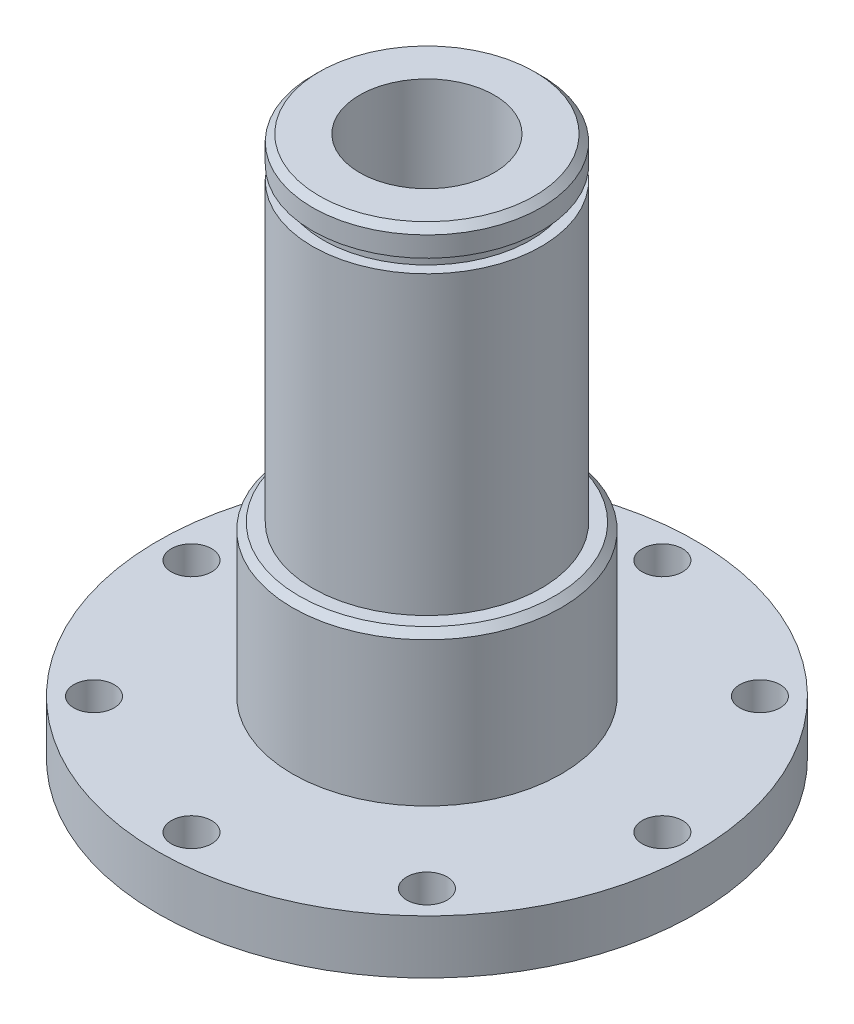
from build123d import *

# Parameters (mm, degrees)
SKETCH_1_R          = 20
EXTRUDE_1_DEPTH     = 4
SKETCH_2_R          = 10
EXTRUDE_2_DEPTH     = 11.2
SKETCH_3_R          = 1.5
CUT_EXTRUDE_1_DEPTH = 31.421045347
SKETCH_4_R          = 8.5
EXTRUDE_3_DEPTH     = 25
SKETCH_5_R          = 5
CUT_EXTRUDE_2_DEPTH = 50.153229802
SKETCH_6_W          = 0.8
SKETCH_6_H          = 1
CHAMFER_1_SIZE      = 0.5


with BuildPart() as part:
    # 草图1 → 凸台-拉伸1 (new body)
    with BuildSketch(Plane(origin=(0, 0, 0), x_dir=(1, 0, 0), z_dir=(0, 1, 0))):
        with Locations(Location((0, 0, 0), (0, 0, 270))):
            Circle(SKETCH_1_R)
    extrude(amount=EXTRUDE_1_DEPTH)

    # 草图2 → 凸台-拉伸2 (add)
    with BuildSketch(Plane(origin=(0, 4, 0), x_dir=(1, 0, 0), z_dir=(0, 1, 0))):
        with Locations(Location((0, 0, 0), (0, 0, 270))):
            Circle(SKETCH_2_R)
    extrude(amount=EXTRUDE_2_DEPTH)

    # 草图3 → 切除-拉伸1 (cut, through all)
    with BuildSketch(Plane(origin=(0, 4, 0), x_dir=(1, 0, 0), z_dir=(0, 1, 0))):
        with Locations(Location((0, 17.5, 0), (0, 0, 270))):
            Circle(SKETCH_3_R)
        with Locations(Location((12.374368671, 12.374368671, 0), (0, 0, 270))):
            Circle(SKETCH_3_R)
        with Locations(Location((17.5, 0, 0), (0, 0, 270))):
            Circle(SKETCH_3_R)
        with Locations(Location((12.374368671, -12.374368671, 0), (0, 0, 270))):
            Circle(SKETCH_3_R)
        with Locations(Location((0, -17.5, 0), (0, 0, 270))):
            Circle(SKETCH_3_R)
        with Locations(Location((-12.374368671, -12.374368671, 0), (0, 0, 270))):
            Circle(SKETCH_3_R)
        with Locations(Location((-17.5, 0, 0), (0, 0, 270))):
            Circle(SKETCH_3_R)
        with Locations(Location((-12.374368671, 12.374368671, 0), (0, 0, 270))):
            Circle(SKETCH_3_R)
    extrude(amount=-CUT_EXTRUDE_1_DEPTH, mode=Mode.SUBTRACT)

    # 草图4 → 凸台-拉伸3 (add)
    with BuildSketch(Plane(origin=(0, 15.2, 0), x_dir=(1, 0, 0), z_dir=(0, 1, 0))):
        with Locations(Location((0, 0, 0), (0, 0, 270))):
            Circle(SKETCH_4_R)
    extrude(amount=EXTRUDE_3_DEPTH)

    # 草图5 → 切除-拉伸2 (cut, through all)
    with BuildSketch(Plane(origin=(0, 40.2, 0), x_dir=(1, 0, 0), z_dir=(0, 1, 0))):
        with Locations(Location((0, 0, 0), (0, 0, 270))):
            Circle(SKETCH_5_R)
    extrude(amount=-CUT_EXTRUDE_2_DEPTH, mode=Mode.SUBTRACT)

    # 草图6 → 切除-旋转1 (revolve, cut)
    with BuildSketch(Plane.XY, mode=Mode.PRIVATE) as cut_revolve_1_sk:
        with Locations((8.1, 37.7)):
            Rectangle(SKETCH_6_W, SKETCH_6_H)
    revolve(cut_revolve_1_sk.sketch.rotate(Axis((0, 40.2, 0), (0, -1, 0)), 90), axis=Axis((0, 40.2, 0), (0, -1, 0)), mode=Mode.SUBTRACT)

    # 倒角1
    chamfer_1_edges = [part.edges().sort_by_distance(p)[0] for p in [
        (0, 40.2, -8.5),
        (0, 15.2, -10),
    ]]
    chamfer(chamfer_1_edges, length=CHAMFER_1_SIZE)


solid = part.part
